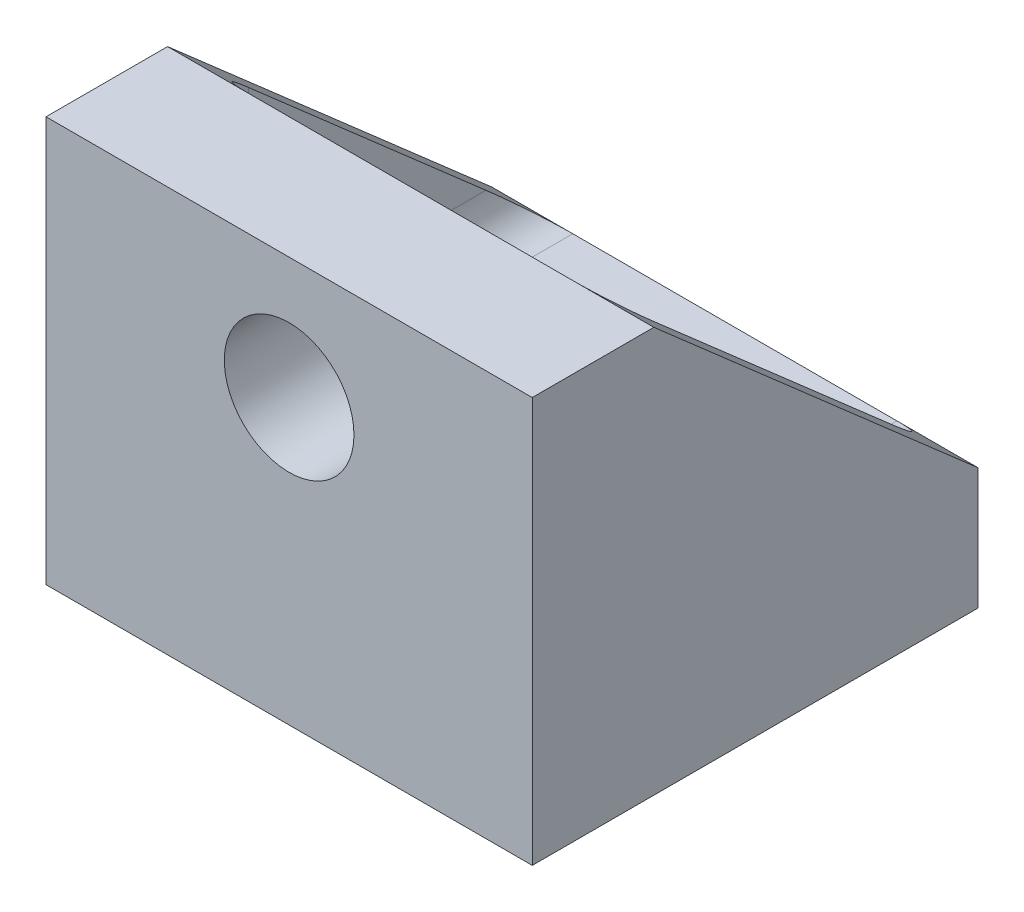
from build123d import *

# Parameters (mm, degrees)
SKETCH2_W           = 10
SKETCH2_H           = 8
SKETCH2_R           = 1.6
BOSS_EXTRUDE1_DEPTH = 3
SKETCH3_W           = 10
SKETCH3_H           = 10
SKETCH3_R           = 1.6
BOSS_EXTRUDE2_DEPTH = 3
BOSS_EXTRUDE3_DEPTH = 1
FILLET1_R           = 1
FILLET2_R           = 1


with BuildPart() as part:
    # Sketch2 → Boss-Extrude1 (new body)
    with BuildSketch(Plane(origin=(0, 0, 0), x_dir=(1, 0, 0), z_dir=(0, 1, 0))):
        Rectangle(SKETCH2_W, SKETCH2_H)
        with Locations(Location((0, 0.5, 0), (0, 0, 270))):
            Circle(SKETCH2_R, mode=Mode.SUBTRACT)
    extrude(amount=BOSS_EXTRUDE1_DEPTH)

    # Sketch3 → Boss-Extrude2 (add)
    with BuildSketch(Plane.XY.offset(4)):
        with Locations((0, 5)):
            Rectangle(SKETCH3_W, SKETCH3_H)
        with Locations((0, 7)):
            Circle(SKETCH3_R, mode=Mode.SUBTRACT)
    extrude(amount=BOSS_EXTRUDE2_DEPTH)

    # Sketch4 → Boss-Extrude3 (add)
    with BuildSketch(Plane.ZY.offset(5)):
        Polygon((-4, 3), (4, 10), (7, 10), (7, 0), (-4, 0), align=None)
    boss_extrude3 = extrude(amount=BOSS_EXTRUDE3_DEPTH)

    # Mirror1: Boss-Extrude3 across plane
    add(boss_extrude3.mirror(Plane(origin=(0, 0, 0), x_dir=(0, 0, 1), z_dir=(1, 0, 0))))

    # Fillet1
    fillet1_edges = [part.edges().sort_by_distance(p)[0] for p in [
        (0, 3, 4),
    ]]
    fillet(fillet1_edges, radius=FILLET1_R)

    # Fillet2
    fillet2_edges = [part.edges().sort_by_distance(p)[0] for p in [
        (-5, 3, -0.5),
        (5, 3, -0.5),
        (5, 7, 4),
        (5, 3.292893219, 3.707106781),
        (-5, 7, 4),
        (-5, 3.292893219, 3.707106781),
    ]]
    fillet(fillet2_edges, radius=FILLET2_R)


solid = part.part
